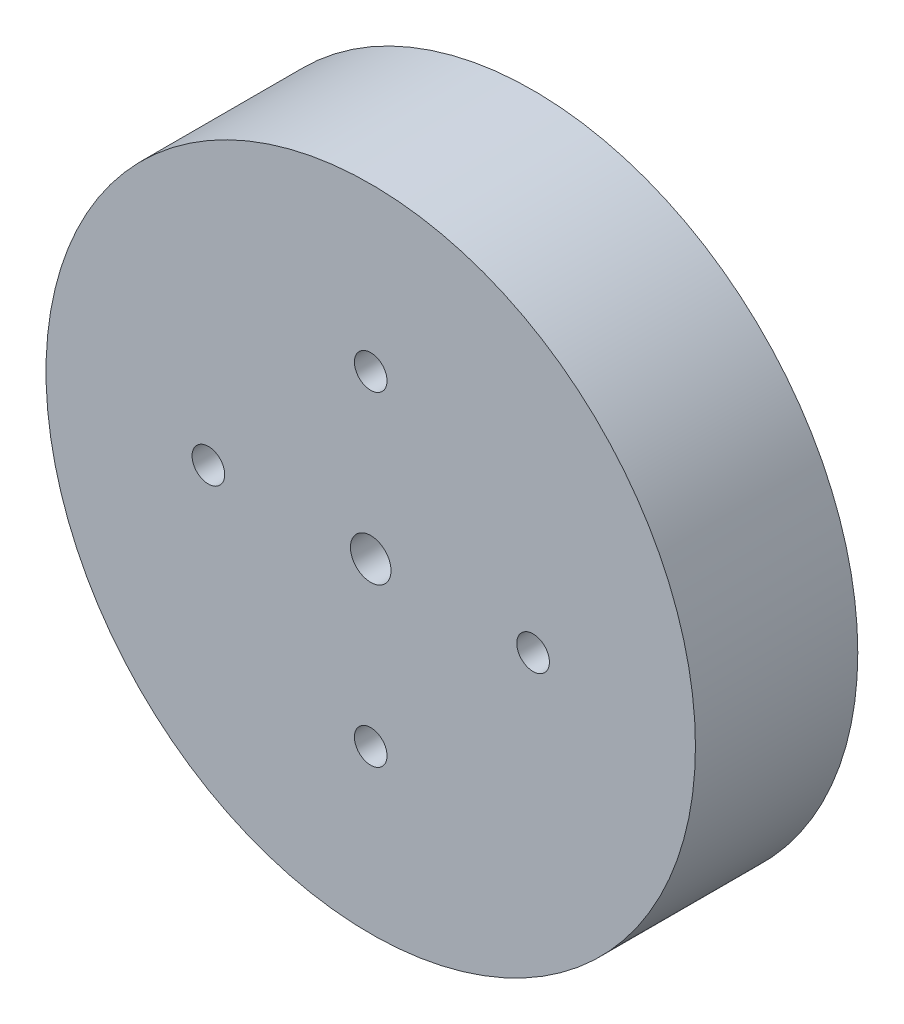
from build123d import *

# Parameters (mm, degrees)
SKETCH1_R                   = 50.8
EXTRUDE1_DEPTH              = 25.4
F_1_4_0_25_DIAMETER_HOLE1_D = 6.35
F_1_4_20_TAPPED_HOLE1_D     = 5.1054
CIRPATTERN1_COUNT           = 4


with BuildPart() as part:
    # Sketch1 → Extrude1 (new body)
    with BuildSketch(Plane.XY):
        Circle(SKETCH1_R)
    extrude(amount=EXTRUDE1_DEPTH)

    # 1/4 (0.25) Diameter Hole1 (through all)
    with Locations(Plane.XY.offset(25.4)):
        with Locations((0, 0)):
            Hole(F_1_4_0_25_DIAMETER_HOLE1_D / 2)

    # 1/4-20 Tapped Hole1 (through all)
    with Locations(Plane(origin=(25.4, 0, 25.4), x_dir=(1, 0, 0), z_dir=(0, 0, 1))):
        with Locations((0, 0)):
            f_1_4_20_tapped_hole1 = Hole(F_1_4_20_TAPPED_HOLE1_D / 2)

    # CirPattern1: 1/4-20 Tapped Hole1 ×4 about axis
    cirpattern1_axis = Axis((0, 0, 0), (0, 0, 1))
    for i in range(1, CIRPATTERN1_COUNT):
        add(f_1_4_20_tapped_hole1.rotate(cirpattern1_axis, i * 360 / CIRPATTERN1_COUNT), mode=Mode.SUBTRACT)


solid = part.part
